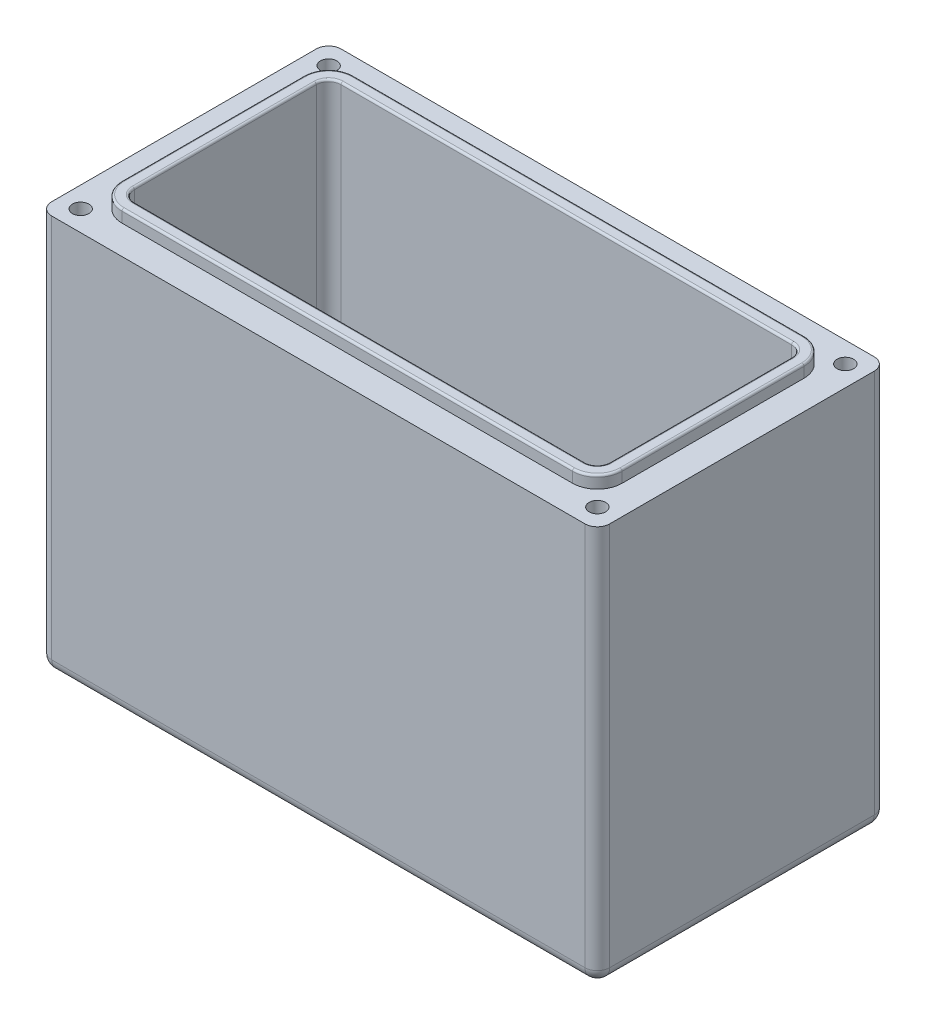
from build123d import *

# Parameters (mm, degrees)
SKETCH1_W           = 135
SKETCH1_H           = 70
BOSS_EXTRUDE1_DEPTH = 96
SKETCH10_W          = 115
SKETCH10_H          = 50
CUT_EXTRUDE7_DEPTH  = 91
SKETCH2_R           = 2.25
CUT_EXTRUDE1_DEPTH  = 178.217380637
SKETCH3_R           = 5
CUT_EXTRUDE2_DEPTH  = 178.217380637
SKETCH6_R           = 2
CUT_EXTRUDE5_DEPTH  = 7.4
CUT_EXTRUDE9_REACH  = 188.188
SKETCH17_R          = 8
SKETCH19_R          = 1
CUT_EXTRUDE12_DEPTH = 20
SKETCH23_R          = 12
CUT_EXTRUDE13_DEPTH = 7
SKETCH7_R           = 8.25
SKETCH7_R_2         = 5
CUT_EXTRUDE14_DEPTH = 4.5
SKETCH24_R          = 3.25
CUT_EXTRUDE15_DEPTH = 2
FILLET1_R           = 3
BOSS_EXTRUDE2_DEPTH = 3
FILLET2_R           = 0.5


with BuildPart() as part:
    # Sketch1 → Boss-Extrude1 (new body)
    with BuildSketch(Plane(origin=(0, 0, 0), x_dir=(1, 0, 0), z_dir=(0, 1, 0))):
        with Locations((67.5, -35)):
            Rectangle(SKETCH1_W, SKETCH1_H)
    extrude(amount=BOSS_EXTRUDE1_DEPTH)

    # Sketch10 → Cut-Extrude7 (cut)
    with BuildSketch(Plane(origin=(0, 96, 0), x_dir=(1, 0, 0), z_dir=(0, 1, 0))):
        with Locations((67.5, -35)):
            Rectangle(SKETCH10_W, SKETCH10_H)
    extrude(amount=-CUT_EXTRUDE7_DEPTH, mode=Mode.SUBTRACT)

    # Sketch2 → Cut-Extrude1 (cut, through all)
    with BuildSketch(Plane(origin=(0, 5, 0), x_dir=(1, 0, 0), z_dir=(0, 1, 0))):
        with Locations(Location((58.96, -21, 0), (0, 0, 270))):
            Circle(SKETCH2_R)
        with Locations(Location((98.96, -21, 0), (0, 0, 270))):
            Circle(SKETCH2_R)
        with Locations(Location((58.96, -49, 0), (0, 0, 270))):
            Circle(SKETCH2_R)
        with Locations(Location((98.96, -49, 0), (0, 0, 270))):
            Circle(SKETCH2_R)
    extrude(amount=-CUT_EXTRUDE1_DEPTH, mode=Mode.SUBTRACT)

    # Sketch3 → Cut-Extrude2 (cut, through all)
    with BuildSketch(Plane(origin=(0, 5, 0), x_dir=(1, 0, 0), z_dir=(0, 1, 0))):
        with Locations(Location((87.5, -35, 0), (0, 0, 270))):
            Circle(SKETCH3_R)
    extrude(amount=-CUT_EXTRUDE2_DEPTH, mode=Mode.SUBTRACT)

    # Sketch6 → Cut-Extrude5 (cut)
    with BuildSketch(Plane(origin=(0, 96, 0), x_dir=(1, 0, 0), z_dir=(0, 1, 0))):
        with Locations(Location((130, -65, 0), (0, 0, 270))):
            Circle(SKETCH6_R)
        with Locations(Location((5, -65, 0), (0, 0, 270))):
            Circle(SKETCH6_R)
        with Locations(Location((5, -5, 0), (0, 0, 270))):
            Circle(SKETCH6_R)
        with Locations(Location((130, -5, 0), (0, 0, 270))):
            Circle(SKETCH6_R)
    extrude(amount=-CUT_EXTRUDE5_DEPTH, mode=Mode.SUBTRACT)

    # Sketch17 → Cut-Extrude9 (cut, up to next)
    with BuildSketch(Plane(origin=(0, 0, 85), x_dir=(0, 0, -1), z_dir=(1, 0, 0)), mode=Mode.PRIVATE) as cut_extrude9_sk1:
        with Locations(Location((50, 56, 0), (0, 0, 180))):
            Circle(SKETCH17_R)
    cut_extrude9_tool1 = extrude(cut_extrude9_sk1.sketch, amount=CUT_EXTRUDE9_REACH, mode=Mode.PRIVATE) & part.part
    add(cut_extrude9_tool1.solids().sort_by_distance((0, 56, 35))[0], mode=Mode.SUBTRACT)

    # Sketch19 → Cut-Extrude12 (cut)
    with BuildSketch(Plane(origin=(0, 88.6, 0), x_dir=(1, 0, 0), z_dir=(0, 1, 0))):
        with Locations(Location((5, -5, 0), (0, 0, 270))):
            Circle(SKETCH19_R)
        with Locations(Location((130, -5, 0), (0, 0, 270))):
            Circle(SKETCH19_R)
        with Locations(Location((130, -65, 0), (0, 0, 270))):
            Circle(SKETCH19_R)
        with Locations(Location((5, -65, 0), (0, 0, 270))):
            Circle(SKETCH19_R)
    extrude(amount=-CUT_EXTRUDE12_DEPTH, mode=Mode.SUBTRACT)

    # Sketch23 → Cut-Extrude13 (cut)
    with BuildSketch(Plane(origin=(10, 0, 0), x_dir=(0, 0, -1), z_dir=(1, 0, 0))):
        with Locations((-35, 56)):
            Circle(SKETCH23_R)
    extrude(amount=-CUT_EXTRUDE13_DEPTH, mode=Mode.SUBTRACT)

    # Sketch7 → Cut-Extrude14 (cut)
    with BuildSketch(Plane(origin=(0, 5, 0), x_dir=(1, 0, 0), z_dir=(0, 1, 0))):
        with Locations(Location((87.5, -35, 0), (0, 0, 270))):
            Circle(SKETCH7_R)
        with Locations(Location((87.5, -35, 0), (0, 0, 270))):
            Circle(SKETCH7_R_2, mode=Mode.SUBTRACT)
    extrude(amount=-CUT_EXTRUDE14_DEPTH, mode=Mode.SUBTRACT)

    # Sketch24 → Cut-Extrude15 (cut)
    with BuildSketch(Plane(origin=(0, 5, 0), x_dir=(1, 0, 0), z_dir=(0, 1, 0))):
        with Locations(Location((58.96, -21, 0), (0, 0, 270))):
            Circle(SKETCH24_R)
        with Locations(Location((98.96, -21, 0), (0, 0, 270))):
            Circle(SKETCH24_R)
        with Locations(Location((58.96, -49, 0), (0, 0, 270))):
            Circle(SKETCH24_R)
        with Locations(Location((98.96, -49, 0), (0, 0, 270))):
            Circle(SKETCH24_R)
    extrude(amount=-CUT_EXTRUDE15_DEPTH, mode=Mode.SUBTRACT)

    # Fillet1
    fillet1_edges = [part.edges().sort_by_distance(p)[0] for p in [
        (67.5, 5, 10),
        (10, 50.5, 10),
        (125, 5, 35),
        (125, 50.5, 10),
        (67.5, 5, 60),
        (125, 50.5, 60),
        (10, 5, 35),
        (10, 50.5, 60),
        (67.5, 0, 0),
        (135, 0, 35),
        (67.5, 0, 70),
        (0, 0, 35),
        (0, 48, 0),
        (135, 48, 0),
        (135, 48, 70),
        (0, 48, 70),
    ]]
    fillet(fillet1_edges, radius=FILLET1_R)

    # Sketch25 → Boss-Extrude2 (add)
    with BuildSketch(Plane(origin=(0, 96, 0), x_dir=(1, 0, 0), z_dir=(0, 1, 0))):
        with BuildLine():
            Line((128, -57), (128, -13))
            ThreePointArc((128, -13), (126.242640687, -8.757359313), (122, -7))
            Line((122, -7), (13, -7))
            ThreePointArc((13, -7), (8.757359313, -8.757359313), (7, -13))
            Line((7, -13), (7, -57))
            ThreePointArc((7, -57), (8.757359313, -61.242640687), (13, -63))
            Line((13, -63), (122, -63))
            ThreePointArc((122, -63), (126.242640687, -61.242640687), (128, -57))
        make_face()
        with BuildLine():
            Line((125, -13), (125, -57))
            ThreePointArc((125, -57), (124.121320344, -59.121320344), (122, -60))
            Line((122, -60), (13, -60))
            ThreePointArc((13, -60), (10.878679656, -59.121320344), (10, -57))
            Line((10, -57), (10, -13))
            ThreePointArc((10, -13), (10.878679656, -10.878679656), (13, -10))
            Line((13, -10), (122, -10))
            ThreePointArc((122, -10), (124.121320344, -10.878679656), (125, -13))
        make_face(mode=Mode.SUBTRACT)
    extrude(amount=BOSS_EXTRUDE2_DEPTH)

    # Fillet2
    fillet2_edges = [part.edges().sort_by_distance(p)[0] for p in [
        (126.242640687, 99, 61.242640687),
        (128, 99, 35),
        (126.242640687, 99, 8.757359313),
        (67.5, 99, 7),
        (8.757359313, 99, 8.757359313),
        (7, 99, 35),
        (8.757359313, 99, 61.242640687),
        (67.5, 99, 63),
        (124.121320344, 99, 10.878679656),
        (67.5, 99, 10),
        (10.878679656, 99, 10.878679656),
        (10, 99, 35),
        (10.878679656, 99, 59.121320344),
        (67.5, 99, 60),
        (124.121320344, 99, 59.121320344),
        (125, 99, 35),
    ]]
    fillet(fillet2_edges, radius=FILLET2_R)


solid = part.part
